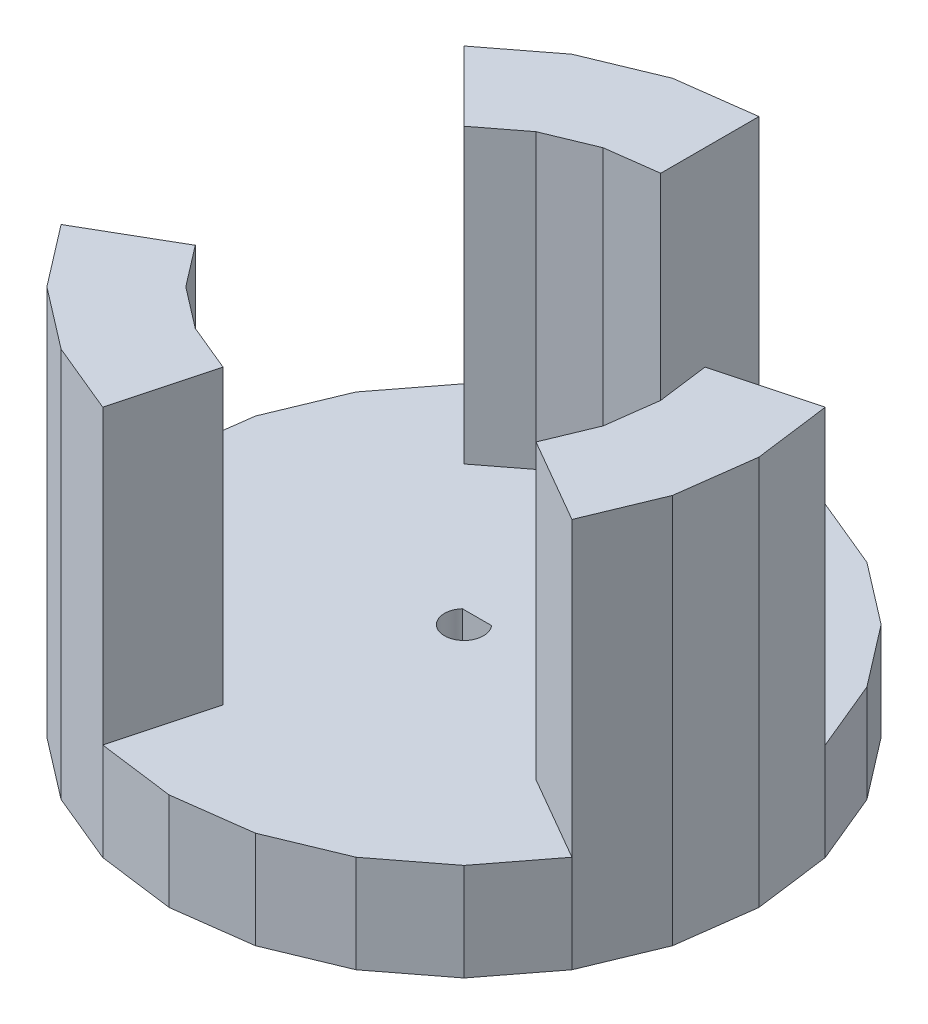
from build123d import *

# Parameters (mm, degrees)
BOSS_EXTRUDE2_DEPTH = 10
BOSS_EXTRUDE3_DEPTH = 40
BOSS_EXTRUDE4_DEPTH = 10


with BuildPart() as part:
    # Sketch1 → Boss-Extrude2 (new body)
    with BuildSketch(Plane(origin=(0, 0, 0), x_dir=(1, 0, 0), z_dir=(0, 1, 0))):
        Polygon((-10.087889227, 17.472736683), (-14.266429761, 14.266429761), (-17.472736683, 10.087889227), (-19.488305475, 5.221875714), (-20.175778455, 0), (-19.488305475, -5.221875714), (-17.472736683, -10.087889227), (-14.266429761, -14.266429761), (-10.087889227, -17.472736683), (-5.221875714, -19.488305475), (0, -20.175778455), (5.221875714, -19.488305475), (10.087889227, -17.472736683), (14.266429761, -14.266429761), (17.472736683, -10.087889227), (19.488305475, -5.221875714), (20.175778455, 0), (19.488305475, 5.221875714), (17.472736683, 10.087889227), (14.266429761, 14.266429761), (10.087889227, 17.472736683), (5.221875714, 19.488305475), (0, 20.175778455), (-5.221875714, 19.488305475), align=None)
        with BuildLine():
            Line((-1.497847768, 1.325312063), (1.497847768, 1.325312063))
            ThreePointArc((1.497847768, 1.325312063), (0, -2), (-1.497847768, 1.325312063))
        make_face(mode=Mode.SUBTRACT)
    extrude(amount=BOSS_EXTRUDE2_DEPTH)

    # Sketch1<5> → Boss-Extrude3 (add)
    with BuildSketch(Plane(origin=(0, 0, 0), x_dir=(1, 0, 0), z_dir=(0, 1, 0))):
        Polygon((-21.389762566, 21.389762566), (-14.266429761, 14.266429761), (-10.087889227, 17.472736683), (-5.221875714, 19.488305475), (0, 20.175778455), (0, 30.249692317), (-7.82919648, 29.218959046), (-15.124846159, 26.197002003), align=None)
        Polygon((-14.266429761, -14.266429761), (-17.472736683, -10.087889227), (-26.197002003, -15.124846159), (-21.389762566, -21.389762566), (-15.124846159, -26.197002003), (-7.82919648, -29.218959046), (-5.221875714, -19.488305475), (-10.087889227, -17.472736683), align=None)
        Polygon((29.218959046, 7.82919648), (19.488305475, 5.221875714), (20.175778455, 0), (19.488305475, -5.221875714), (17.472736683, -10.087889227), (26.197002003, -15.124846159), (29.218959046, -7.82919648), (30.249692317, 0), align=None)
    extrude(amount=BOSS_EXTRUDE3_DEPTH)

    # Sketch1<7> → Boss-Extrude4 (add)
    with BuildSketch(Plane(origin=(0, 0, 0), x_dir=(1, 0, 0), z_dir=(0, 1, 0))):
        Polygon((-17.472736683, 10.087889227), (-14.266429761, 14.266429761), (-21.389762566, 21.389762566), (-26.197002003, 15.124846159), (-29.218959046, 7.82919648), (-30.249692317, 0), (-29.218959046, -7.82919648), (-26.197002003, -15.124846159), (-17.472736683, -10.087889227), (-19.488305475, -5.221875714), (-20.175778455, 0), (-19.488305475, 5.221875714), align=None)
        Polygon((0, 30.249692317), (0, 20.175778455), (5.221875714, 19.488305475), (10.087889227, 17.472736683), (14.266429761, 14.266429761), (17.472736683, 10.087889227), (19.488305475, 5.221875714), (29.218959046, 7.82919648), (26.197002003, 15.124846159), (21.389762566, 21.389762566), (15.124846159, 26.197002003), (7.82919648, 29.218959046), align=None)
        Polygon((0, -20.175778455), (-5.221875714, -19.488305475), (-7.82919648, -29.218959046), (0, -30.249692317), (7.82919648, -29.218959046), (15.124846159, -26.197002003), (21.389762566, -21.389762566), (26.197002003, -15.124846159), (17.472736683, -10.087889227), (14.266429761, -14.266429761), (10.087889227, -17.472736683), (5.221875714, -19.488305475), align=None)
    extrude(amount=BOSS_EXTRUDE4_DEPTH)


solid = part.part
